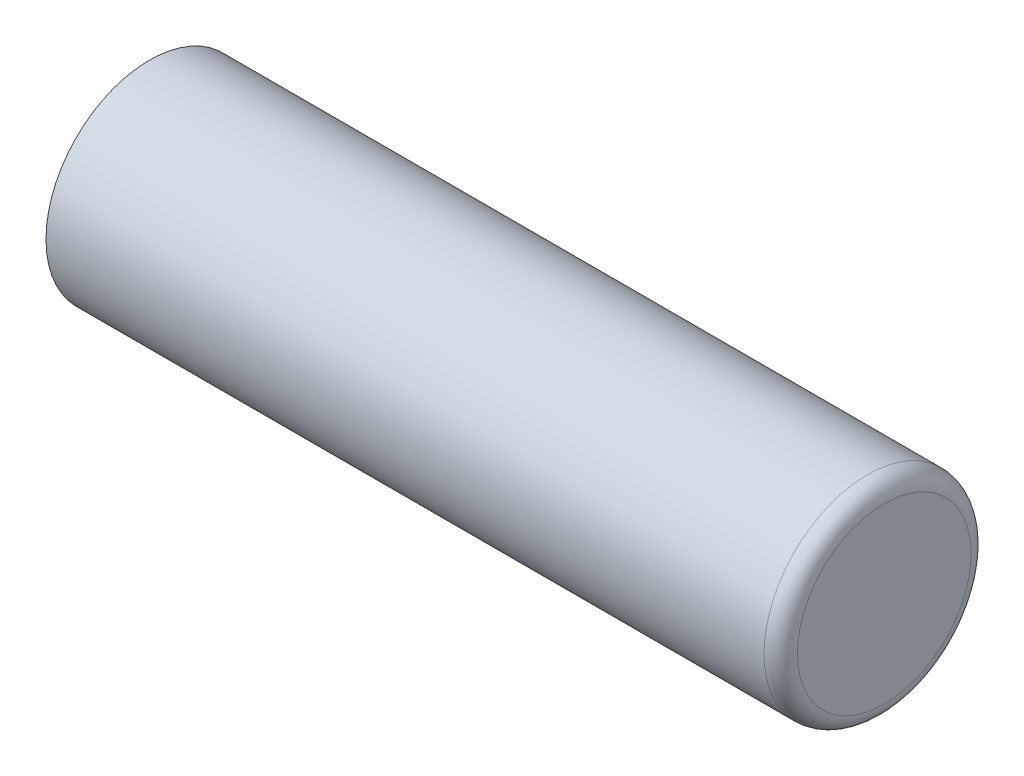
from build123d import *


with BuildPart() as part:
    # Sketch1 → Revolve1 (revolve)
    with BuildSketch(Plane(origin=(0, 0, 0), x_dir=(1, 0, 0), z_dir=(0, 1, 0)), mode=Mode.PRIVATE) as revolve1_sk:
        with BuildLine():
            Line((-11, 3.1), (10.5, 3.1))
            ThreePointArc((10.5, 3.1), (10.853553391, 2.953553391), (11, 2.6))
            Line((11, 2.6), (11, 0))
            Line((11, 0), (-11, 0))
            Line((-11, 0), (-11, 3.1))
        make_face()
    revolve(revolve1_sk.sketch.rotate(Axis((-11, 0, 0), (1, 0, 0)), 180), axis=Axis((-11, 0, 0), (1, 0, 0)))


solid = part.part
